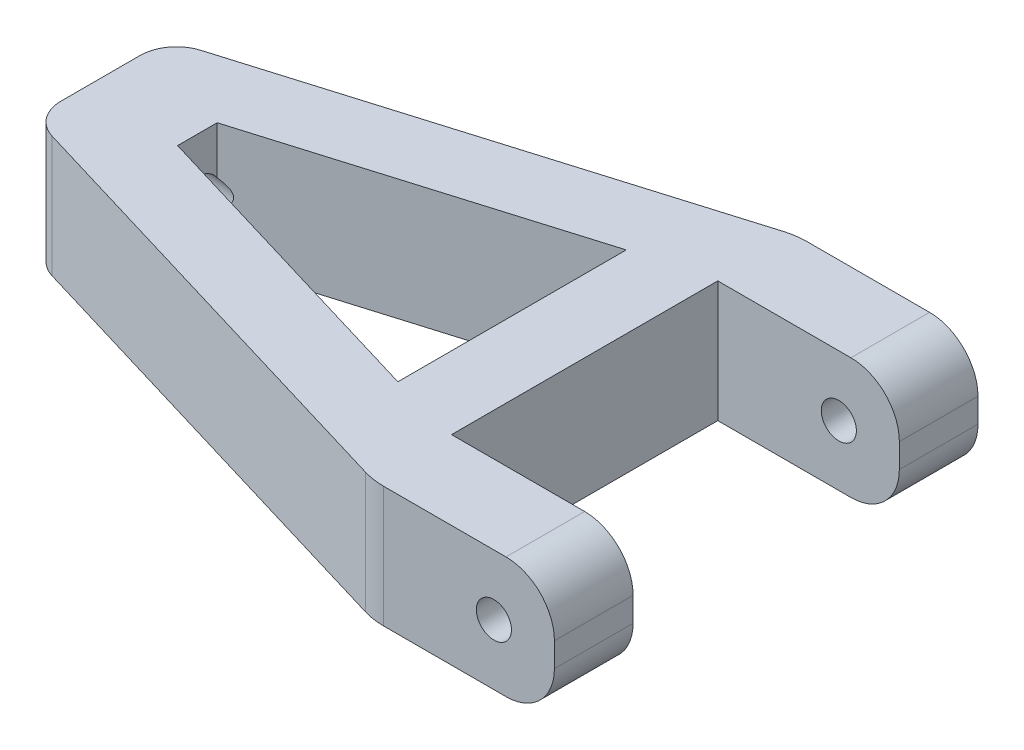
from build123d import *

# Parameters (mm, degrees)
SKETCH1_W           = 55
SKETCH1_H           = 35
BOSS_EXTRUDE1_DEPTH = 10
CUT_EXTRUDE6_DEPTH  = 66.954529791
SKETCH12_R          = 1.45
CUT_EXTRUDE8_DEPTH  = 66.954529791
SKETCH13_R          = 1.95
CUT_EXTRUDE9_DEPTH  = 11
SKETCH2_W           = 22
SKETCH2_H           = 10
CUT_EXTRUDE10_DEPTH = 15
FILLET4_R           = 4
FILLET5_R           = 3
FILLET6_R           = 6
CUT_EXTRUDE11_DEPTH = 66.954529791


with BuildPart() as part:
    # Sketch1 → Boss-Extrude1 (new body)
    with BuildSketch(Plane(origin=(0, 0, 0), x_dir=(1, 0, 0), z_dir=(0, 1, 0))):
        with Locations((27.5, -17.5)):
            Rectangle(SKETCH1_W, SKETCH1_H)
    extrude(amount=BOSS_EXTRUDE1_DEPTH)

    # Sketch9 → Cut-Extrude6 (cut, through all)
    with BuildSketch(Plane(origin=(0, 0, 0), x_dir=(-1, 0, 0), z_dir=(0, -1, 0))):
        Polygon((0, -12), (-40, 0), (0, 0), align=None)
        Polygon((0, -23), (-40, -35), (0, -35), align=None)
    extrude(amount=-CUT_EXTRUDE6_DEPTH, mode=Mode.SUBTRACT)

    # Sketch12 → Cut-Extrude8 (cut, through all)
    with BuildSketch(Plane.XY.offset(35)):
        with Locations((50, 5)):
            Circle(SKETCH12_R)
    extrude(amount=-CUT_EXTRUDE8_DEPTH, mode=Mode.SUBTRACT)

    # Sketch13 → Cut-Extrude9 (cut)
    with BuildSketch(Plane.ZY):
        with Locations((17.5, 5)):
            Circle(SKETCH13_R)
    extrude(amount=-CUT_EXTRUDE9_DEPTH, mode=Mode.SUBTRACT)

    # Sketch2 → Cut-Extrude10 (cut)
    with BuildSketch(Plane(origin=(55, 0, 0), x_dir=(0, 0, -1), z_dir=(1, 0, 0))):
        with Locations((-17.5, 5)):
            Rectangle(SKETCH2_W, SKETCH2_H)
    extrude(amount=-CUT_EXTRUDE10_DEPTH, mode=Mode.SUBTRACT)

    # Fillet4
    fillet4_edges = [part.edges().sort_by_distance(p)[0] for p in [
        (55, 10, 31.75),
        (55, 0, 3.25),
        (55, 10, 3.25),
        (55, 0, 31.75),
    ]]
    fillet(fillet4_edges, radius=FILLET4_R)

    # Fillet5
    fillet5_edges = [part.edges().sort_by_distance(p)[0] for p in [
        (0, 5, 12),
        (0, 5, 23),
    ]]
    fillet(fillet5_edges, radius=FILLET5_R)

    # Fillet6
    fillet6_edges = [part.edges().sort_by_distance(p)[0] for p in [
        (40, 5, 0),
        (40, 5, 35),
    ]]
    fillet(fillet6_edges, radius=FILLET6_R)

    # Sketch15 → Cut-Extrude11 (cut, through all)
    with BuildSketch(Plane(origin=(0, 0, 0), x_dir=(-1, 0, 0), z_dir=(0, -1, 0))):
        Polygon((-34, -26.935816095), (-8, -19.135816095), (-8, -15.864183905), (-34, -8.064183905), align=None)
    extrude(amount=-CUT_EXTRUDE11_DEPTH, mode=Mode.SUBTRACT)


solid = part.part
